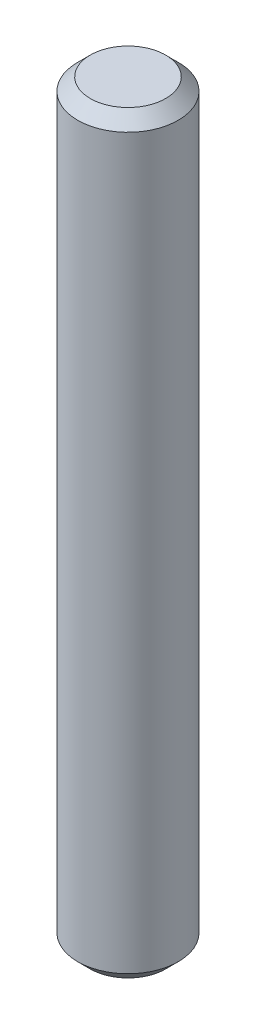
from build123d import *

# Parameters (mm, degrees)
SKETCH1_R           = 2
BOSS_EXTRUDE1_DEPTH = 15
CHAMFER1_SIZE       = 0.5


with BuildPart() as part:
    # Sketch1 → Boss-Extrude1 (new, symmetric)
    with BuildSketch(Plane(origin=(0, 0, 0), x_dir=(1, 0, 0), z_dir=(0, 1, 0))):
        with Locations(Location((0, 0, 0), (0, 0, 270))):
            Circle(SKETCH1_R)
    extrude(amount=BOSS_EXTRUDE1_DEPTH, both=True)

    # Chamfer1
    chamfer1_edges = [part.edges().sort_by_distance(p)[0] for p in [
        (0, -15, -2),
        (0, 15, -2),
    ]]
    chamfer(chamfer1_edges, length=CHAMFER1_SIZE)


solid = part.part
